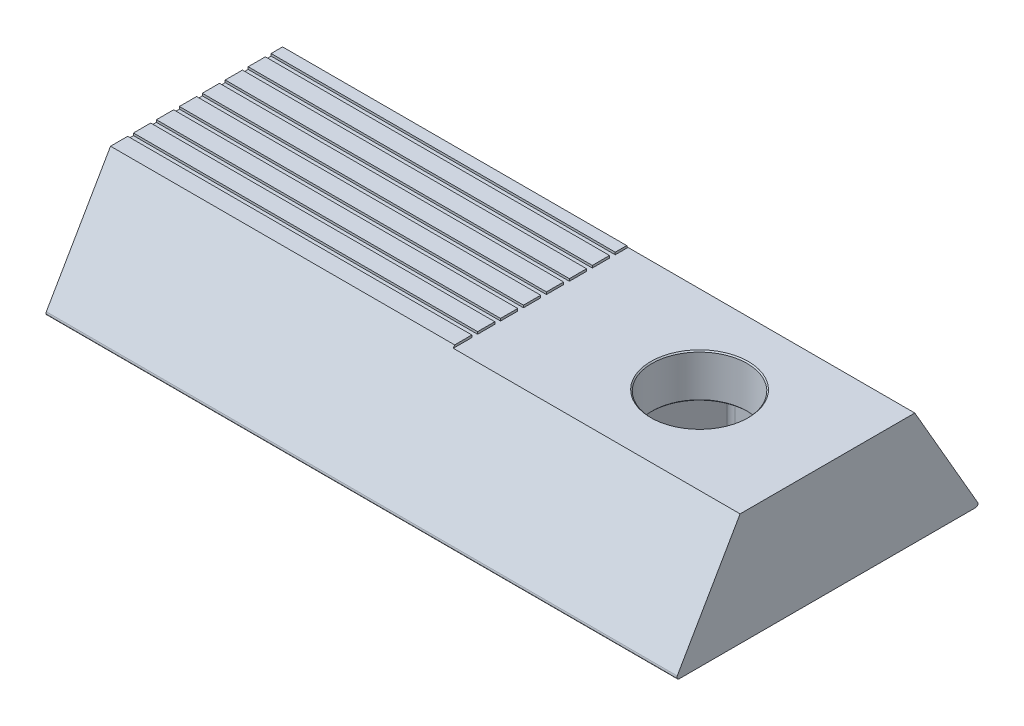
from build123d import *

# Parameters (mm, degrees)
SKETCH1_R                       = 4.15
BOSS_EXTRUDE1_DEPTH             = 10
CUT_EXTRUDE2_DEPTH              = 42.907636536
CUT_EXTRUDE2_DEPTH_BACK         = 42.907636536
SKETCH2_W                       = 0.5
SKETCH2_H                       = 0.2
BOSS_EXTRUDE2_REACH             = 43.908
BOSS_EXTRUDE2_DIRECTION_2_REACH = 43.908
SKETCH10_W                      = 15.230940108
SKETCH10_H                      = 0.2
CUT_EXTRUDE6_DEPTH              = 25
CUT_EXTRUDE5_DEPTH              = 6
FILLET3_R                       = 0.5
CHAMFER1_SIZE                   = 0.1


with BuildPart() as part:
    # Sketch1 → Boss-Extrude1 (new body)
    with BuildSketch(Plane(origin=(0, 0, 0), x_dir=(1, 0, 0), z_dir=(0, 1, 0))):
        Polygon((-15, -7.5), (15, -7.5), (40, -7.5), (40, 7.5), (15, 7.5), (-15, 7.5), align=None)
        with Locations(Location((28.85, 0, 0), (0, 0, 270))):
            Circle(SKETCH1_R, mode=Mode.SUBTRACT)
    extrude(amount=BOSS_EXTRUDE1_DEPTH)

    # Sketch2 → Cut-Extrude2 (cut, two sides: drawn at the far end of the back side and taken through both)
    with BuildSketch(Plane(origin=(0, 0, 0), x_dir=(0, 0, -1), z_dir=(1, 0, 0)).offset(-CUT_EXTRUDE2_DEPTH_BACK)):
        with Locations((-5.75, 9.9)):
            Rectangle(SKETCH2_W, SKETCH2_H)
        with Locations((-3.75, 9.9)):
            Rectangle(SKETCH2_W, SKETCH2_H)
        with Locations((-1.75, 9.9)):
            Rectangle(SKETCH2_W, SKETCH2_H)
        with Locations((0.25, 9.9)):
            Rectangle(SKETCH2_W, SKETCH2_H)
        with Locations((2.25, 9.9)):
            Rectangle(SKETCH2_W, SKETCH2_H)
        with Locations((4.25, 9.9)):
            Rectangle(SKETCH2_W, SKETCH2_H)
        with Locations((6.25, 9.9)):
            Rectangle(SKETCH2_W, SKETCH2_H)
    extrude(amount=CUT_EXTRUDE2_DEPTH + CUT_EXTRUDE2_DEPTH_BACK, mode=Mode.SUBTRACT)

    # Boss-Extrude2: up to this face of the body (flat: up to its plane)
    boss_extrude2_end = Plane(part.part.faces().sort_by_distance((40, 4.977026122, 0.001172137))[0])
    # Sketch3 → Boss-Extrude2 (add, up to the picked face)
    with BuildSketch(Plane(origin=(0, 0, 0), x_dir=(0, 0, -1), z_dir=(1, 0, 0)), mode=Mode.PRIVATE) as boss_extrude2_sk1:
        with BuildLine():
            Line((7.5, 10), (13.097822121, 0.304287674))
            ThreePointArc((13.097822121, 0.304287674), (13.097822121, 0.101429225), (12.92214155, 0))
            Line((12.92214155, 0), (7.5, 0))
            Line((7.5, 0), (7.5, 10))
        make_face()
    boss_extrude2_tool1 = split(extrude(boss_extrude2_sk1.sketch, amount=BOSS_EXTRUDE2_REACH, mode=Mode.PRIVATE), bisect_by=boss_extrude2_end, keep=Keep.BOTH, mode=Mode.PRIVATE)
    # Sketch3 → Boss-Extrude2 (add, up to the picked face)
    with BuildSketch(Plane(origin=(0, 0, 0), x_dir=(0, 0, -1), z_dir=(1, 0, 0)), mode=Mode.PRIVATE) as boss_extrude2_sk2:
        with BuildLine():
            Line((-7.5, 0), (-7.5, 10))
            Line((-7.5, 10), (-13.097822121, 0.304287674))
            ThreePointArc((-13.097822121, 0.304287674), (-13.097822121, 0.101429225), (-12.92214155, 0))
            Line((-12.92214155, 0), (-7.5, 0))
        make_face()
    boss_extrude2_tool2 = split(extrude(boss_extrude2_sk2.sketch, amount=BOSS_EXTRUDE2_REACH, mode=Mode.PRIVATE), bisect_by=boss_extrude2_end, keep=Keep.BOTH, mode=Mode.PRIVATE)
    add(boss_extrude2_tool1.solids().sort_by(Axis((0, 3.336518, -9.420866), (1, 0, 0)))[0])
    add(boss_extrude2_tool2.solids().sort_by(Axis((0, 3.336518, 9.420866), (1, 0, 0)))[0])

    # Boss-Extrude2 direction 2: up to this face of the body (flat: up to its plane)
    boss_extrude2_direction_2_end = Plane(part.part.faces().sort_by_distance((-15, 4.977026122, 0.001172137))[0])
    # Sketch3 → Boss-Extrude2 direction 2 (add, up to the picked face)
    with BuildSketch(Plane(origin=(0, 0, 0), x_dir=(0, 0, -1), z_dir=(1, 0, 0)), mode=Mode.PRIVATE) as boss_extrude2_direction_2_sk1:
        with BuildLine():
            Line((7.5, 10), (13.097822121, 0.304287674))
            ThreePointArc((13.097822121, 0.304287674), (13.097822121, 0.101429225), (12.92214155, 0))
            Line((12.92214155, 0), (7.5, 0))
            Line((7.5, 0), (7.5, 10))
        make_face()
    boss_extrude2_direction_2_tool1 = split(extrude(boss_extrude2_direction_2_sk1.sketch, amount=-BOSS_EXTRUDE2_DIRECTION_2_REACH, mode=Mode.PRIVATE), bisect_by=boss_extrude2_direction_2_end, keep=Keep.BOTH, mode=Mode.PRIVATE)
    # Sketch3 → Boss-Extrude2 direction 2 (add, up to the picked face)
    with BuildSketch(Plane(origin=(0, 0, 0), x_dir=(0, 0, -1), z_dir=(1, 0, 0)), mode=Mode.PRIVATE) as boss_extrude2_direction_2_sk2:
        with BuildLine():
            Line((-7.5, 0), (-7.5, 10))
            Line((-7.5, 10), (-13.097822121, 0.304287674))
            ThreePointArc((-13.097822121, 0.304287674), (-13.097822121, 0.101429225), (-12.92214155, 0))
            Line((-12.92214155, 0), (-7.5, 0))
        make_face()
    boss_extrude2_direction_2_tool2 = split(extrude(boss_extrude2_direction_2_sk2.sketch, amount=-BOSS_EXTRUDE2_DIRECTION_2_REACH, mode=Mode.PRIVATE), bisect_by=boss_extrude2_direction_2_end, keep=Keep.BOTH, mode=Mode.PRIVATE)
    add(boss_extrude2_direction_2_tool1.solids().sort_by(Axis((0, 3.336518, -9.420866), (-1, 0, 0)))[0])
    add(boss_extrude2_direction_2_tool2.solids().sort_by(Axis((0, 3.336518, 9.420866), (-1, 0, 0)))[0])

    # Sketch10 → Cut-Extrude6 (cut)
    with BuildSketch(Plane(origin=(40, 0, 0), x_dir=(0, 0, -1), z_dir=(1, 0, 0))):
        with Locations((0, 9.9)):
            Rectangle(SKETCH10_W, SKETCH10_H)
    extrude(amount=-CUT_EXTRUDE6_DEPTH, mode=Mode.SUBTRACT)

    # Sketch8 → Cut-Extrude5 (cut)
    with BuildSketch(Plane.XZ):
        Polygon((25.039488223, -6.6), (32.660511777, -6.6), (36.471023553, 0), (32.660511777, 6.6), (25.039488223, 6.6), (21.228976447, 0), align=None)
    extrude(amount=-CUT_EXTRUDE5_DEPTH, mode=Mode.SUBTRACT)

    # Fillet3
    fillet3_edges = [part.edges().sort_by_distance(p)[0] for p in [
        (25.039488223, 3, -6.6),
        (21.228976447, 3, 0),
        (25.039488223, 3, 6.6),
        (32.660511777, 3, 6.6),
        (36.471023553, 3, 0),
        (32.660511777, 3, -6.6),
    ]]
    fillet(fillet3_edges, radius=FILLET3_R)

    # Chamfer1
    chamfer1_edges = [part.edges().sort_by_distance(p)[0] for p in [
        (28.85, 9.8, -4.15),
        (28.85, 6, -4.15),
    ]]
    chamfer(chamfer1_edges, length=CHAMFER1_SIZE)


solid = part.part
